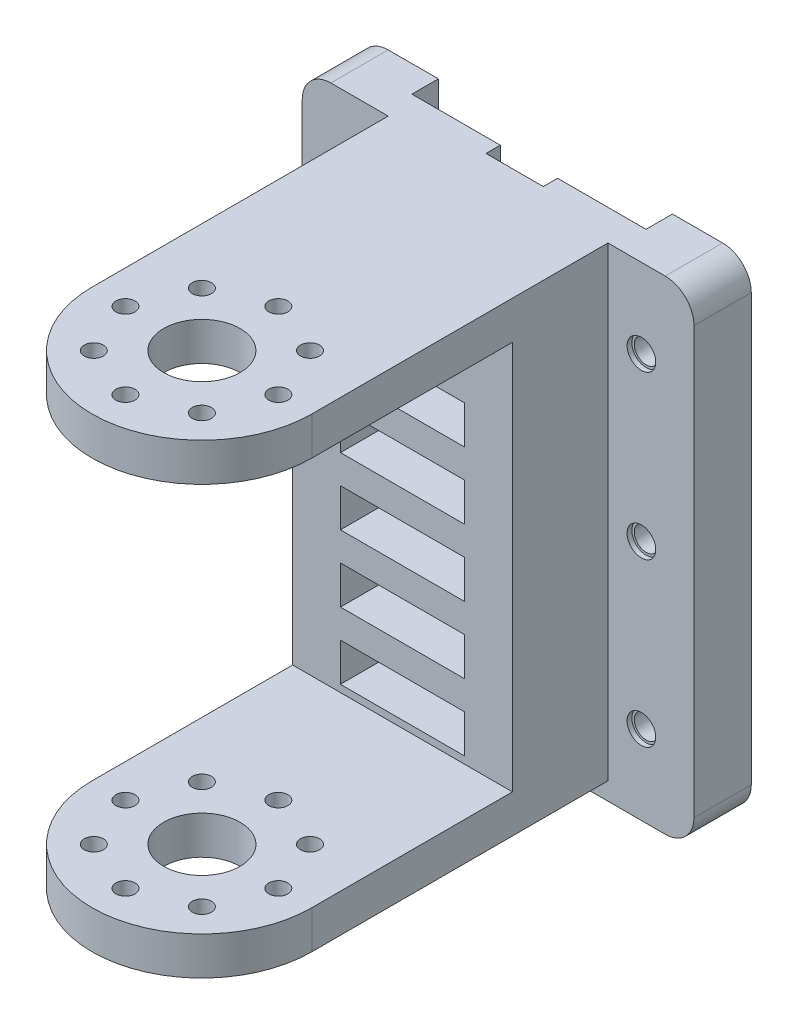
from build123d import *

# Parameters (mm, degrees)
SKETCH1_W           = 41
SKETCH1_H           = 50.6
BOSS_EXTRUDE1_DEPTH = 6
FILLET1_R           = 3
SKETCH3_R           = 1.25
CUT_EXTRUDE1_DEPTH  = 34.111025354
SKETCH4_R           = 1.5
CUT_EXTRUDE2_DEPTH  = 0.5
SKETCH5_W           = 24.5
SKETCH5_H           = 46
CUT_EXTRUDE3_DEPTH  = 2.77
SKETCH6_W           = 6
SKETCH6_H           = 16
CUT_EXTRUDE4_DEPTH  = 1.5
SKETCH7_W           = 23
SKETCH7_H           = 48.75
SKETCH7_W_2         = 13
SKETCH7_H_2         = 4.000096304
BOSS_EXTRUDE2_DEPTH = 10
SKETCH8_W           = 23
SKETCH8_H           = 4
BOSS_EXTRUDE3_DEPTH = 44
SKETCH9_R           = 1
CUT_EXTRUDE5_DEPTH  = 82.120959067


with BuildPart() as part:
    # Sketch1 → Boss-Extrude1 (new body)
    with BuildSketch(Plane.XY):
        Rectangle(SKETCH1_W, SKETCH1_H)
    extrude(amount=BOSS_EXTRUDE1_DEPTH)

    # Fillet1
    fillet1_edges = [part.edges().sort_by_distance(p)[0] for p in [
        (20.5, -25.3, 3),
        (-20.5, -25.3, 3),
        (-20.5, 25.3, 3),
        (20.5, 25.3, 3),
    ]]
    fillet(fillet1_edges, radius=FILLET1_R)

    # Sketch3 → Cut-Extrude1 (cut, through all)
    with BuildSketch(Plane.XY.offset(6)):
        with Locations((-15, 0)):
            Circle(SKETCH3_R)
        with Locations((-15, 17)):
            Circle(SKETCH3_R)
        with Locations((-15, -17)):
            Circle(SKETCH3_R)
    cut_extrude1 = extrude(amount=-CUT_EXTRUDE1_DEPTH, mode=Mode.SUBTRACT)

    # Mirror1: Cut-Extrude1 across plane
    add(cut_extrude1.mirror(Plane(origin=(0, 0, 0), x_dir=(0, 0, 1), z_dir=(1, 0, 0))), mode=Mode.SUBTRACT)

    # Sketch4 → Cut-Extrude2 (cut)
    with BuildSketch(Plane.XY.offset(6)):
        with Locations((-15, 17)):
            Circle(SKETCH4_R)
        with Locations((-15, 0)):
            Circle(SKETCH4_R)
        with Locations((-15, -17)):
            Circle(SKETCH4_R)
    cut_extrude2 = extrude(amount=-CUT_EXTRUDE2_DEPTH, mode=Mode.SUBTRACT)

    # Mirror2: Cut-Extrude2 across plane
    add(cut_extrude2.mirror(Plane(origin=(0, 0, 0), x_dir=(0, 0, 1), z_dir=(1, 0, 0))), mode=Mode.SUBTRACT)

    # Sketch5 → Cut-Extrude3 (cut)
    with BuildSketch(Plane(origin=(0, 0, 0), x_dir=(-1, 0, 0), z_dir=(0, 0, -1))):
        with Locations((0, 2.3)):
            Rectangle(SKETCH5_W, SKETCH5_H)
    extrude(amount=-CUT_EXTRUDE3_DEPTH, mode=Mode.SUBTRACT)

    # Sketch6 → Cut-Extrude4 (cut)
    with BuildSketch(Plane(origin=(0, 0, 2.77), x_dir=(-1, 0, 0), z_dir=(0, 0, -1))):
        with Locations((0, 17.3)):
            Rectangle(SKETCH6_W, SKETCH6_H)
    extrude(amount=-CUT_EXTRUDE4_DEPTH, mode=Mode.SUBTRACT)

    # Sketch7 → Boss-Extrude2 (add)
    with BuildSketch(Plane.XY.offset(6)):
        with Locations((0, 0.925)):
            Rectangle(SKETCH7_W, SKETCH7_H)
        with Locations((0, 11.300440592)):
            Rectangle(SKETCH7_W_2, SKETCH7_H_2, mode=Mode.SUBTRACT)
        with Locations((0, 18.300440592)):
            Rectangle(SKETCH7_W_2, SKETCH7_H_2, mode=Mode.SUBTRACT)
        with Locations((0, 4.300440592)):
            Rectangle(SKETCH7_W_2, SKETCH7_H_2, mode=Mode.SUBTRACT)
        with Locations((0, -2.699559408)):
            Rectangle(SKETCH7_W_2, SKETCH7_H_2, mode=Mode.SUBTRACT)
        with Locations((0, -9.699559408)):
            Rectangle(SKETCH7_W_2, SKETCH7_H_2, mode=Mode.SUBTRACT)
        with Locations((0, -16.699559408)):
            Rectangle(SKETCH7_W_2, SKETCH7_H_2, mode=Mode.SUBTRACT)
    extrude(amount=BOSS_EXTRUDE2_DEPTH)

    # Sketch8 → Boss-Extrude3 (add)
    with BuildSketch(Plane.XY.offset(16)):
        with Locations((0, 23.3)):
            Rectangle(SKETCH8_W, SKETCH8_H)
        with Locations((0, -21.45)):
            Rectangle(SKETCH8_W, SKETCH8_H)
    extrude(amount=BOSS_EXTRUDE3_DEPTH)

    # Sketch9 → Cut-Extrude5 (cut, through all)
    with BuildSketch(Plane(origin=(0, 25.3, 0), x_dir=(1, 0, 0), z_dir=(0, 1, 0))):
        with BuildLine():
            Line((11.5, -60), (11.5, -37))
            ThreePointArc((11.5, -37), (0, -48.5), (-11.5, -37))
            Line((-11.5, -37), (-11.5, -60))
            Line((-11.5, -60), (11.5, -60))
        make_face()
        with BuildLine():
            ThreePointArc((-4, -37), (0, -41), (4, -37))
            Line((4, -37), (-4, -37))
        make_face()
        with BuildLine():
            Line((-4, -37), (4, -37))
            ThreePointArc((4, -37), (0, -33), (-4, -37))
        make_face()
        with Locations(Location((0, -29, 0), (0, 0, 180))):
            Circle(SKETCH9_R)
        with Locations(Location((-5.656854249, -31.343145751, 0), (0, 0, 180))):
            Circle(SKETCH9_R)
        with BuildLine():
            ThreePointArc((-7, -37), (-8, -36), (-9, -37))
            Line((-9, -37), (-7, -37))
        make_face()
        with BuildLine():
            Line((-7, -37), (-9, -37))
            ThreePointArc((-9, -37), (-8, -38), (-7, -37))
        make_face()
        with Locations(Location((-5.656854249, -42.656854249, 0), (0, 0, 180))):
            Circle(SKETCH9_R)
        with Locations(Location((0, -45, 0), (0, 0, 180))):
            Circle(SKETCH9_R)
        with Locations(Location((5.656854249, -42.656854249, 0), (0, 0, 180))):
            Circle(SKETCH9_R)
        with BuildLine():
            ThreePointArc((7, -37), (8, -38), (9, -37))
            Line((9, -37), (7, -37))
        make_face()
        with BuildLine():
            Line((7, -37), (9, -37))
            ThreePointArc((9, -37), (8, -36), (7, -37))
        make_face()
        with Locations(Location((5.656854249, -31.343145751, 0), (0, 0, 180))):
            Circle(SKETCH9_R)
    extrude(amount=-CUT_EXTRUDE5_DEPTH, mode=Mode.SUBTRACT)


solid = part.part
